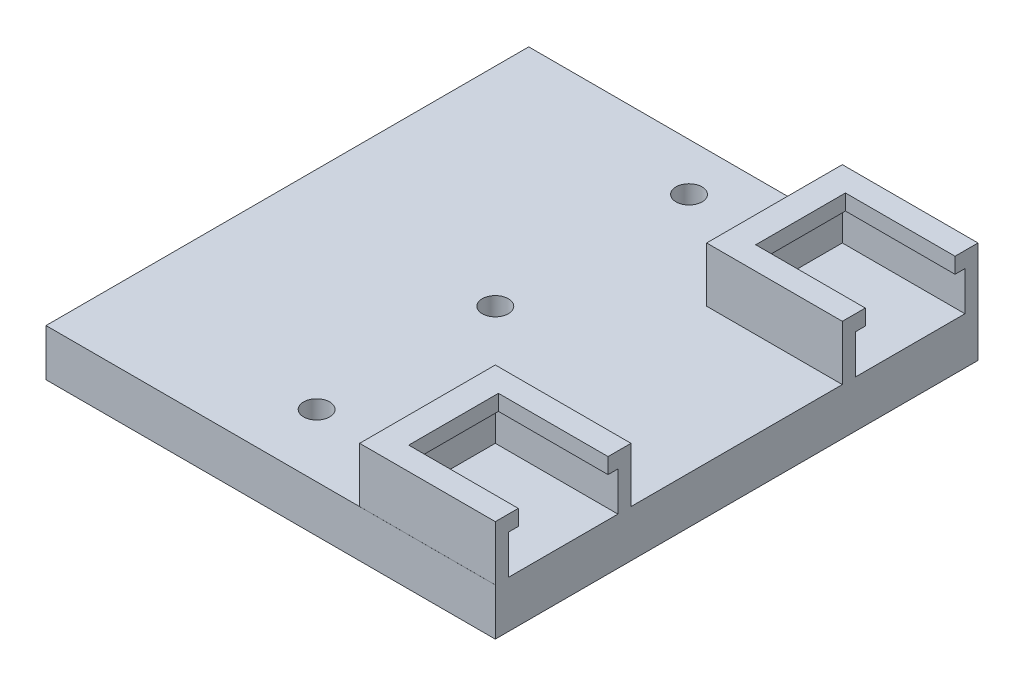
from build123d import *

# Parameters (mm, degrees)
SKETCH1_W            = 133
SKETCH1_H            = 133
BOSS_EXTRUDE2_DEPTH  = 136
SKETCH2_W            = 133
SKETCH2_H            = 118
CUT_EXTRUDE1_DEPTH   = 136
BOSS_EXTRUDE3_DEPTH  = 10.5
SKETCH5_W            = 21
SKETCH5_H            = 3
BOSS_EXTRUDE4_DEPTH  = 23.5
SKETCH6_W            = 42
SKETCH6_H            = 17.2
CUT_EXTRUDE2_DEPTH   = 3
BOSS_EXTRUDE5_DEPTH  = 10.5
SKETCH8_W            = 21
SKETCH8_H            = 3
BOSS_EXTRUDE6_DEPTH  = 23.5
SKETCH9_W            = 42
SKETCH9_H            = 17.2
CUT_EXTRUDE3_DEPTH   = 3
SKETCH10_W           = 19.261488562
SKETCH10_H           = 133
BOSS_EXTRUDE7_DEPTH  = 5
SKETCH11_W           = 18.43727499
SKETCH11_H           = 133
BOSS_EXTRUDE8_DEPTH  = 5
SKETCH12_W           = 18.849381776
SKETCH12_H           = 146
BOSS_EXTRUDE9_DEPTH  = 12
SKETCH14_W           = 18.849381776
SKETCH14_H           = 146
BOSS_EXTRUDE10_DEPTH = 12
SKETCH17_R           = 1
CUT_EXTRUDE4_DEPTH   = 222.251553667
SKETCH20_W           = 133.244561713
SKETCH20_H           = 5
CUT_EXTRUDE10_DEPTH  = 19
SKETCH21_W           = 157
SKETCH21_H           = 120.66580897
CUT_EXTRUDE11_DEPTH  = 118
SKETCH22_W           = 186.174267818
SKETCH22_H           = 42.2523161
CUT_EXTRUDE12_DEPTH  = 118
SKETCH23_W           = 12
SKETCH23_H           = 25.33419103
CUT_EXTRUDE13_DEPTH  = 118
SKETCH24_W           = 12
SKETCH24_H           = 25.33419103
CUT_EXTRUDE14_DEPTH  = 118
SKETCH31_R           = 2.5
CUT_EXTRUDE21_DEPTH  = 118
SKETCH32_R           = 2.5
CUT_EXTRUDE22_DEPTH  = 118
SKETCH33_W           = 133
SKETCH33_H           = 5
CUT_EXTRUDE24_DEPTH  = 118
SKETCH34_R           = 2.5
CUT_EXTRUDE25_DEPTH  = 118
SKETCH35_W           = 133
SKETCH35_H           = 133
SKETCH35_W_2         = 86.097023631
SKETCH35_H_2         = 92.508019
CUT_EXTRUDE27_DEPTH  = 10
SKETCH36_R           = 2.5
CUT_EXTRUDE28_DEPTH  = 178
SKETCH37_R           = 2.5
CUT_EXTRUDE29_DEPTH  = 42


with BuildPart() as part:
    # Sketch1 → Boss-Extrude2 (new body)
    with BuildSketch(Plane(origin=(0, 0, 0), x_dir=(1, 0, 0), z_dir=(0, 1, 0))):
        Rectangle(SKETCH1_W, SKETCH1_H)
    extrude(amount=BOSS_EXTRUDE2_DEPTH)

    # Sketch2 → Cut-Extrude1 (cut)
    with BuildSketch(Plane.XY.offset(66.5)):
        with Locations((0, 68)):
            Rectangle(SKETCH2_W, SKETCH2_H)
    extrude(amount=-CUT_EXTRUDE1_DEPTH, mode=Mode.SUBTRACT)


with BuildPart() as cut_extrude1_piece_1:
    # of the separate pieces the step leaves, piece 1, a body of its own (cut_extrude1_pieces)
    add(part.part.solids().sort_by_distance((-66.5, 0, 66.5))[0])

    # Sketch4 → Boss-Extrude3 (add)
    with BuildSketch(Plane(origin=(0, 9, 0), x_dir=(1, 0, 0), z_dir=(0, 1, 0))):
        Polygon((22.75, -22.75), (43.75, -22.75), (46.25, -22.75), (46.25, -20.25), (20.25, -20.25), (20.25, -46.25), (46.25, -46.25), (46.25, -43.75), (43.75, -43.75), (22.75, -43.75), align=None)
        Polygon((22.75, 43.75), (43.75, 43.75), (46.25, 43.75), (46.25, 46.25), (20.25, 46.25), (20.25, 20.25), (46.25, 20.25), (46.25, 22.75), (43.75, 22.75), (22.75, 22.75), align=None)
    extrude(amount=BOSS_EXTRUDE3_DEPTH)

    # Sketch5 → Boss-Extrude4 (add)
    with BuildSketch(Plane(origin=(22.75, 0, 0), x_dir=(0, 0, -1), z_dir=(1, 0, 0))):
        with Locations((-33.25, 18)):
            Rectangle(SKETCH5_W, SKETCH5_H)
        with Locations((33.25, 18)):
            Rectangle(SKETCH5_W, SKETCH5_H)
    extrude(amount=BOSS_EXTRUDE4_DEPTH)

    # Sketch6 → Cut-Extrude2 (cut)
    with BuildSketch(Plane(origin=(0, 19.5, 0), x_dir=(1, 0, 0), z_dir=(0, 1, 0))):
        with Locations((46.25, -33.25)):
            Rectangle(SKETCH6_W, SKETCH6_H)
        with Locations((46.25, 33.25)):
            Rectangle(SKETCH6_W, SKETCH6_H)
    extrude(amount=-CUT_EXTRUDE2_DEPTH, mode=Mode.SUBTRACT)

    # Sketch10 → Boss-Extrude7 (add)
    with BuildSketch(Plane.XZ):
        Rectangle(SKETCH10_W, SKETCH10_H)
    extrude(amount=BOSS_EXTRUDE7_DEPTH)



with BuildPart() as cut_extrude1_piece_2:
    # of the separate pieces the step leaves, piece 2, a body of its own (cut_extrude1_pieces)
    add(part.part.solids().sort_by_distance((66.5, 127, 66.5))[0])

    # Sketch7 → Boss-Extrude5 (add)
    with BuildSketch(Plane.XZ.offset(-127)):
        Polygon((-43.75, 43.75), (-22.75, 43.75), (-22.75, 22.75), (-43.75, 22.75), (-46.25, 22.75), (-46.25, 20.25), (-20.25, 20.25), (-20.25, 46.25), (-46.25, 46.25), (-46.25, 43.75), align=None)
        Polygon((-43.75, -22.75), (-22.75, -22.75), (-22.75, -43.75), (-43.75, -43.75), (-46.25, -43.75), (-46.25, -46.25), (-20.25, -46.25), (-20.25, -20.25), (-46.25, -20.25), (-46.25, -22.75), align=None)
    extrude(amount=BOSS_EXTRUDE5_DEPTH)

    # Sketch8 → Boss-Extrude6 (add)
    with BuildSketch(Plane.ZY.offset(22.75)):
        with Locations((33.25, 118)):
            Rectangle(SKETCH8_W, SKETCH8_H)
        with Locations((-33.25, 118)):
            Rectangle(SKETCH8_W, SKETCH8_H)
    extrude(amount=BOSS_EXTRUDE6_DEPTH)

    # Sketch9 → Cut-Extrude3 (cut)
    with BuildSketch(Plane.XZ.offset(-116.5)):
        with Locations((-46.25, 33.25)):
            Rectangle(SKETCH9_W, SKETCH9_H)
        with Locations((-46.25, -33.25)):
            Rectangle(SKETCH9_W, SKETCH9_H)
    extrude(amount=-CUT_EXTRUDE3_DEPTH, mode=Mode.SUBTRACT)

    # Sketch11 → Boss-Extrude8 (add)
    with BuildSketch(Plane(origin=(0, 136, 0), x_dir=(1, 0, 0), z_dir=(0, 1, 0))):
        Rectangle(SKETCH11_W, SKETCH11_H)
    extrude(amount=BOSS_EXTRUDE8_DEPTH)


with BuildPart() as cut_extrude1_piece_1_1:
    add(cut_extrude1_piece_1.part)

    add(cut_extrude1_piece_2.part)  # Boss-Extrude9 merges Cut-Extrude1 piece 2
    # Sketch12 → Boss-Extrude9 (add)
    with BuildSketch(Plane(origin=(0, 0, -66.5), x_dir=(-1, 0, 0), z_dir=(0, 0, -1))):
        with Locations((-0.206053393, 68)):
            Rectangle(SKETCH12_W, SKETCH12_H)
    extrude(amount=BOSS_EXTRUDE9_DEPTH)

    # Sketch14 → Boss-Extrude10 (add)
    with BuildSketch(Plane.XY.offset(66.5)):
        with Locations((0.206053393, 68)):
            Rectangle(SKETCH14_W, SKETCH14_H)
    extrude(amount=BOSS_EXTRUDE10_DEPTH)

    # Sketch17 → Cut-Extrude4 (cut, through all)
    with BuildSketch(Plane.XY.offset(78.5)):
        with Locations((0.206053393, 68)):
            Circle(SKETCH17_R)
    extrude(amount=-CUT_EXTRUDE4_DEPTH, mode=Mode.SUBTRACT)

    # Sketch20 → Cut-Extrude10 (cut)
    with BuildSketch(Plane.ZY.offset(9.218637495)):
        with Locations((0.122280857, 138.5)):
            Rectangle(SKETCH20_W, SKETCH20_H)
    extrude(amount=-CUT_EXTRUDE10_DEPTH, mode=Mode.SUBTRACT)

    # Sketch21 → Cut-Extrude11 (cut)
    with BuildSketch(Plane.ZY.offset(9.218637495)):
        with Locations((0, 80.667095515)):
            Rectangle(SKETCH21_W, SKETCH21_H)
    extrude(amount=-CUT_EXTRUDE11_DEPTH, mode=Mode.SUBTRACT)


with BuildPart() as cut_extrude11_piece_1:
    # of the separate pieces the step leaves, piece 1, a body of its own (cut_extrude11_pieces)
    add(cut_extrude1_piece_1_1.part.solids().sort_by_distance((9.630744281, 20.33419103, 66.5))[0])

    # Sketch23 → Cut-Extrude13 (cut)
    with BuildSketch(Plane.ZY.offset(9.218637495)):
        with Locations((-72.5, 7.667095515)):
            Rectangle(SKETCH23_W, SKETCH23_H)
    extrude(amount=-CUT_EXTRUDE13_DEPTH, mode=Mode.SUBTRACT)

    # Sketch24 → Cut-Extrude14 (cut)
    with BuildSketch(Plane.ZY.offset(9.218637495)):
        with Locations((72.5, 7.667095515)):
            Rectangle(SKETCH24_W, SKETCH24_H)
    extrude(amount=-CUT_EXTRUDE14_DEPTH, mode=Mode.SUBTRACT)

    # Sketch31 → Cut-Extrude21 (cut)
    with BuildSketch(Plane.XZ.offset(5)):
        with Locations(Location((0, 59.499471122, 0), (0, 0, 270))):
            Circle(SKETCH31_R)
    extrude(amount=-CUT_EXTRUDE21_DEPTH, mode=Mode.SUBTRACT)

    # Sketch32 → Cut-Extrude22 (cut)
    with BuildSketch(Plane.XZ.offset(5)):
        with Locations(Location((0, -59.159797643, 0), (0, 0, 270))):
            Circle(SKETCH32_R)
    extrude(amount=-CUT_EXTRUDE22_DEPTH, mode=Mode.SUBTRACT)

    # Sketch33 → Cut-Extrude24 (cut)
    with BuildSketch(Plane.ZY.offset(9.630744281)):
        with Locations((0, -2.5)):
            Rectangle(SKETCH33_W, SKETCH33_H)
    extrude(amount=-CUT_EXTRUDE24_DEPTH, mode=Mode.SUBTRACT)

    # Sketch34 → Cut-Extrude25 (cut)
    with BuildSketch(Plane(origin=(0, 9, 0), x_dir=(1, 0, 0), z_dir=(0, 1, 0))):
        with Locations(Location((0, 0, 0), (0, 0, 270))):
            Circle(SKETCH34_R)
    extrude(amount=-CUT_EXTRUDE25_DEPTH, mode=Mode.SUBTRACT)

    # Sketch35 → Cut-Extrude27 (cut)
    with BuildSketch(Plane(origin=(0, 9, 0), x_dir=(1, 0, 0), z_dir=(0, 1, 0))):
        Rectangle(SKETCH35_W, SKETCH35_H)
        with Locations((3.201488185, -0.0040095)):
            Rectangle(SKETCH35_W_2, SKETCH35_H_2, mode=Mode.SUBTRACT)
    extrude(amount=-CUT_EXTRUDE27_DEPTH, mode=Mode.SUBTRACT)

    # Sketch36 → Cut-Extrude28 (cut)
    with BuildSketch(Plane(origin=(0, 9, 0), x_dir=(1, 0, 0), z_dir=(0, 1, 0))):
        with Locations(Location((0, 37.126366322, 0), (0, 0, 270))):
            Circle(SKETCH36_R)
    extrude(amount=-CUT_EXTRUDE28_DEPTH, mode=Mode.SUBTRACT)

    # Sketch37 → Cut-Extrude29 (cut)
    with BuildSketch(Plane(origin=(0, 9, 0), x_dir=(1, 0, 0), z_dir=(0, 1, 0))):
        with Locations(Location((0, -34.245307912, 0), (0, 0, 270))):
            Circle(SKETCH37_R)
    extrude(amount=-CUT_EXTRUDE29_DEPTH, mode=Mode.SUBTRACT)


with BuildPart() as cut_extrude11_piece_2:
    # of the separate pieces the step leaves, piece 2, a body of its own (cut_extrude11_pieces)
    add(cut_extrude1_piece_1_1.part.solids().sort_by_distance((-9.218637495, 127, 66.5))[0])

    # Sketch22 → Cut-Extrude12 (cut)
    with BuildSketch(Plane.ZY.offset(66.5)):
        with Locations((20.706035589, 120.536042421)):
            Rectangle(SKETCH22_W, SKETCH22_H)
    extrude(amount=-CUT_EXTRUDE12_DEPTH, mode=Mode.SUBTRACT)


solid = cut_extrude11_piece_1.part
